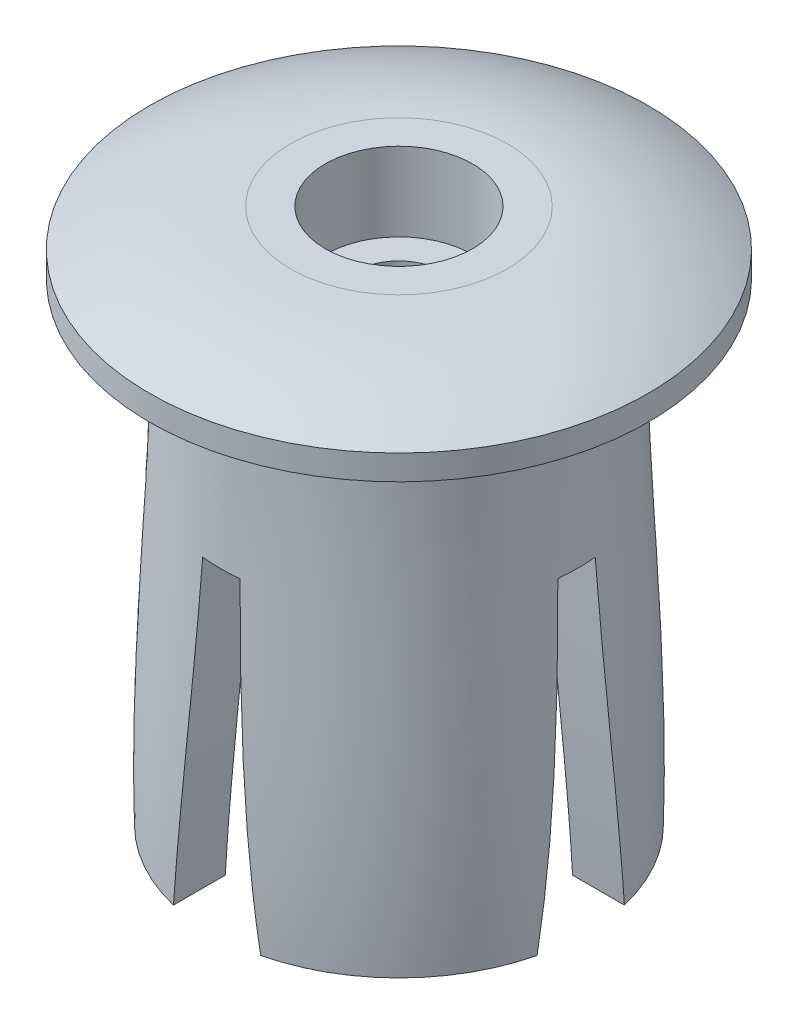
from build123d import *

# Parameters (mm, degrees)
SHELL1_T                                = -2.54
CUT_EXTRUDE2_DEPTH                      = 38.003022678
CIRPATTERN1_COUNT                       = 2
CIRPATTERN1_ANGLE                       = 90
BOSS_EXTRUDE3_DEPTH                     = 6.985
BOSS_EXTRUDE3_DEPTH_BACK                = 2.54
SKETCH13_R                              = 8.663884536
CBORE_FOR_M5_HEX_HEAD_BOLT2_D           = 4.5
CBORE_FOR_M5_HEX_HEAD_BOLT2_CBORE_D     = 7.5
CBORE_FOR_M5_HEX_HEAD_BOLT2_CBORE_DEPTH = 4


with BuildPart() as part:
    # Sketch1 → Revolve1 (revolve)
    with BuildSketch(Plane.XY, mode=Mode.PRIVATE) as revolve1_sk:
        with BuildLine():
            Line((0, 23.722851324), (5.5245, 23.722851324))
            ThreePointArc((5.5245, 23.722851324), (9.236535333, 23.238492745), (12.7, 21.817851324))
            Line((12.7, 21.817851324), (12.7, 20.547851324))
            Line((12.7, 20.547851324), (8.89, 20.547851324))
            add(Edge.make_bspline(
                [(8.89, 20.547851324), (8.84961008, 12.497906194), (9.741228483, 4.469234919), (9.525, -3.582148676)],
                knots=[0, 0, 0, 0, 1, 1, 1, 1], degree=3))
            Line((9.525, -3.582148676), (0, -3.582148676))
            Line((0, -3.582148676), (0, 23.722851324))
        make_face()
    revolve(revolve1_sk.sketch.rotate(Axis((0, 23.722851324, 0), (0, -1, 0)), 180), axis=Axis((0, 23.722851324, 0), (0, -1, 0)))

    # Shell1
    shell1_openings = [part.faces().sort_by_distance(p)[0] for p in [
        (0, -3.582148676, 0),
    ]]
    offset(amount=SHELL1_T, openings=shell1_openings, kind=Kind.INTERSECTION)

    # Sketch4 → Cut-Extrude2 (cut, through all)
    with BuildSketch(Plane.XY.offset(12.7)):
        with BuildLine():
            Line((0.9525, 12.292851324), (-0.9525, 12.292851324))
            add(Edge.make_bspline(
                [(-0.9525, 12.292851324), (-1.266575854, 4.327293664), (-2.2225, -3.582148676)],
                knots=[0, 0, 0, 1, 1, 1], degree=2))
            Line((-2.2225, -3.582148676), (2.2225, -3.582148676))
            add(Edge.make_bspline(
                [(0.9525, 12.292851324), (1.266575854, 4.327293664), (2.2225, -3.582148676)],
                knots=[0, 0, 0, 1, 1, 1], degree=2))
        make_face()
    cut_extrude2 = extrude(amount=-CUT_EXTRUDE2_DEPTH, mode=Mode.SUBTRACT)

    # CirPattern1: Cut-Extrude2 ×2 about axis
    cirpattern1_axis = Axis((0, 0, 0), (0, -1, 0))
    for i in range(1, CIRPATTERN1_COUNT):
        add(cut_extrude2.rotate(cirpattern1_axis, i * CIRPATTERN1_ANGLE / (CIRPATTERN1_COUNT - 1)), mode=Mode.SUBTRACT)

    # Sketch13 → Boss-Extrude3 (add, two sides: drawn at the far end of the back side and taken through both)
    with BuildSketch(Plane.XZ.offset(-20.547851324).offset(-BOSS_EXTRUDE3_DEPTH_BACK)):
        Circle(SKETCH13_R)
    extrude(amount=BOSS_EXTRUDE3_DEPTH + BOSS_EXTRUDE3_DEPTH_BACK)

    # CBORE for M5 Hex Head Bolt2 (through all)
    with Locations(Plane(origin=(0, 23.722851324, 0), x_dir=(-1, 0, 0), z_dir=(0, 1, 0))):
        with Locations((0, 0)):
            CounterBoreHole(CBORE_FOR_M5_HEX_HEAD_BOLT2_D / 2, CBORE_FOR_M5_HEX_HEAD_BOLT2_CBORE_D / 2, CBORE_FOR_M5_HEX_HEAD_BOLT2_CBORE_DEPTH)


solid = part.part
